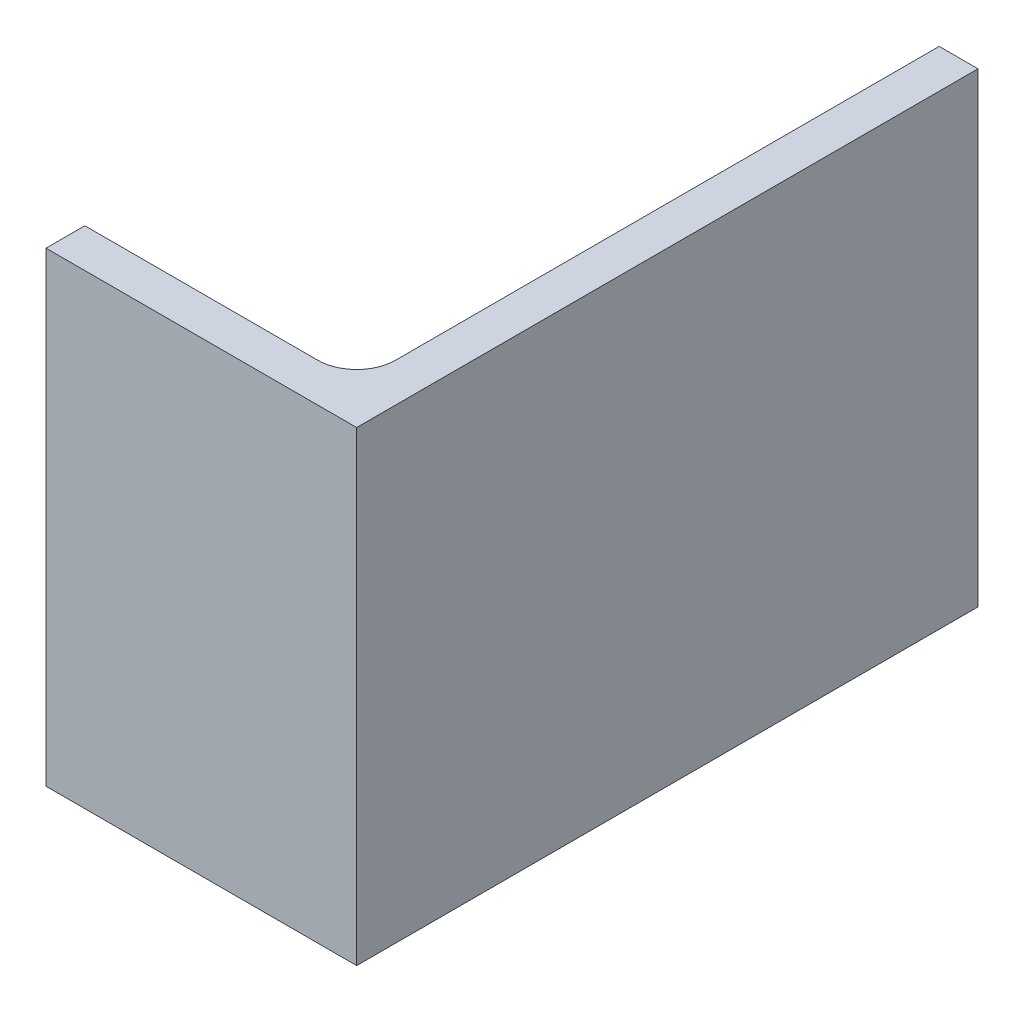
from build123d import *

# Parameters (mm, degrees)
SKETCH1_W           = 25.4
SKETCH1_H           = 38.1
BOSS_EXTRUDE1_DEPTH = 50.8
SHELL1_T            = -3.175
FILLET1_R           = 3.175


with BuildPart() as part:
    # Sketch1 → Boss-Extrude1 (new body)
    with BuildSketch(Plane.XY):
        Rectangle(SKETCH1_W, SKETCH1_H)
    extrude(amount=-BOSS_EXTRUDE1_DEPTH)

    # Shell1
    shell1_openings = [part.faces().sort_by_distance(p)[0] for p in [
        (0, 0, -50.8),
        (-12.7, 0, -25.4),
        (0, 19.05, -25.4),
    ]]
    offset(amount=SHELL1_T, openings=shell1_openings, kind=Kind.INTERSECTION)

    # Fillet1
    fillet1_edges = [part.edges().sort_by_distance(p)[0] for p in [
        (9.525, -15.875, -26.9875),
        (9.525, 1.5875, -3.175),
        (-1.5875, -15.875, -3.175),
    ]]
    fillet(fillet1_edges, radius=FILLET1_R)


solid = part.part
